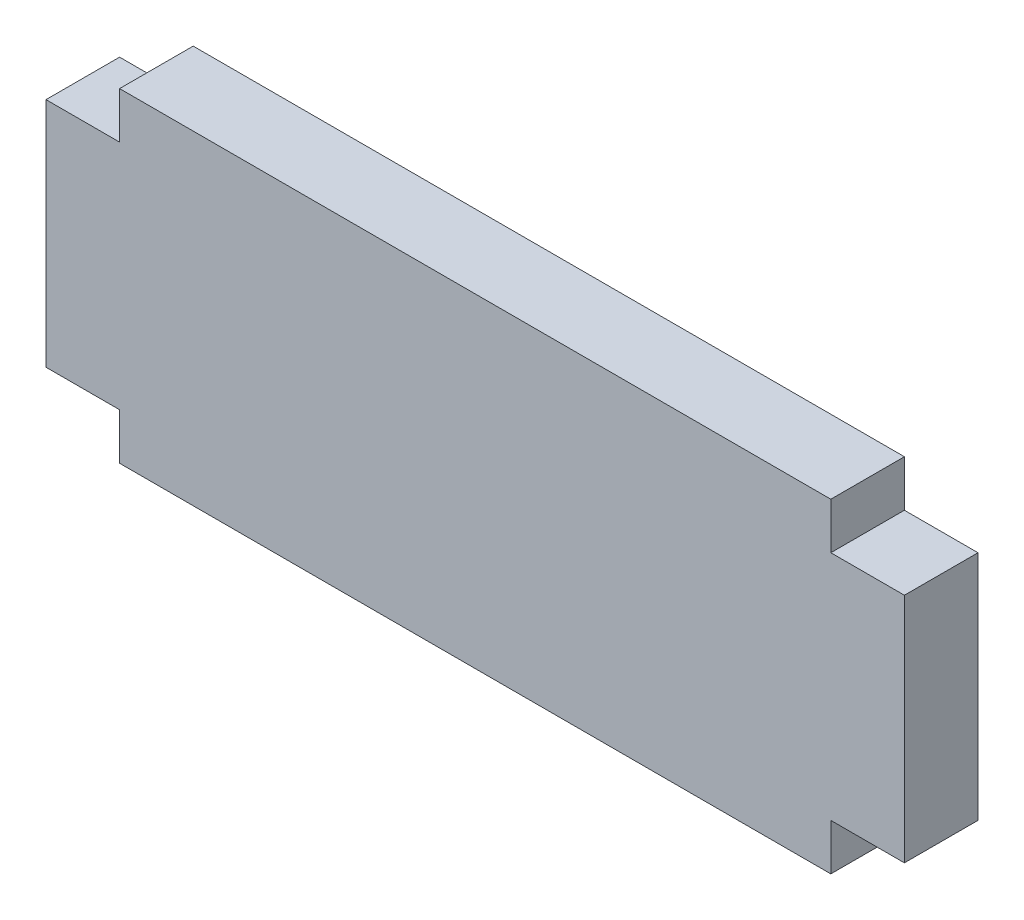
from build123d import *

# Parameters (mm, degrees)
SKETCH2_W           = 3.175
SKETCH2_H           = 10
SKETCH2_W_2         = 30.6846
SKETCH2_H_2         = 14
BOSS_EXTRUDE1_DEPTH = 3.175


with BuildPart() as part:
    # Sketch2 → Boss-Extrude1 (new body)
    with BuildSketch(Plane.XY):
        with Locations((-16.9298, 0)):
            Rectangle(SKETCH2_W, SKETCH2_H)
        Rectangle(SKETCH2_W_2, SKETCH2_H_2)
        with Locations((16.9298, 0)):
            Rectangle(SKETCH2_W, SKETCH2_H)
    extrude(amount=BOSS_EXTRUDE1_DEPTH)


solid = part.part
